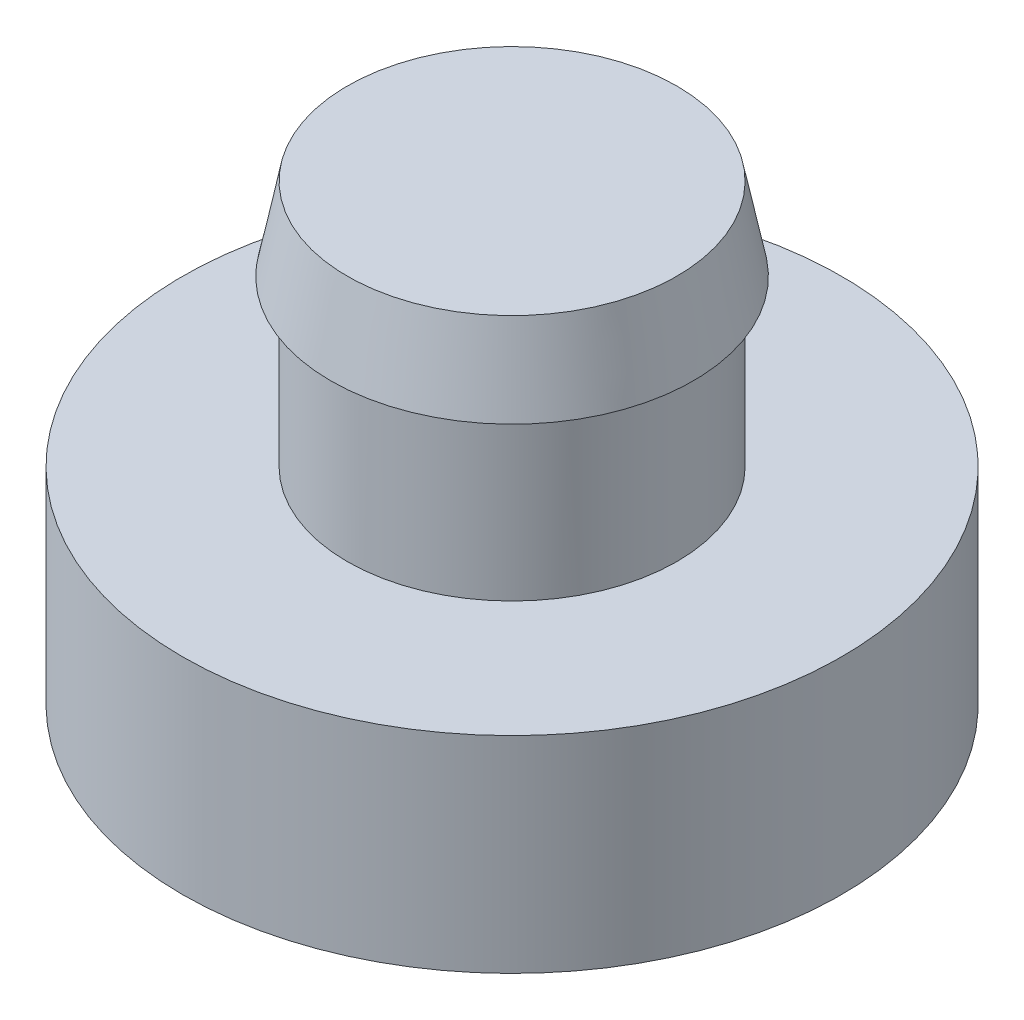
from build123d import *

# Parameters (mm, degrees)
SKETCH1_R           = 4
BOSS_EXTRUDE1_DEPTH = 2.5
SKETCH2_R           = 2
BOSS_EXTRUDE2_DEPTH = 3


with BuildPart() as part:
    # Sketch1 → Boss-Extrude1 (new body)
    with BuildSketch(Plane(origin=(0, 0, 0), x_dir=(1, 0, 0), z_dir=(0, 1, 0))):
        with Locations(Location((0, 0, 0), (0, 0, 270))):
            Circle(SKETCH1_R)
    extrude(amount=BOSS_EXTRUDE1_DEPTH)

    # Sketch2 → Boss-Extrude2 (add)
    with BuildSketch(Plane(origin=(0, 2.5, 0), x_dir=(1, 0, 0), z_dir=(0, 1, 0))):
        with Locations(Location((0, 0, 0), (0, 0, 270))):
            Circle(SKETCH2_R)
    extrude(amount=BOSS_EXTRUDE2_DEPTH)

    # Sketch3 → Revolve1 (revolve)
    with BuildSketch(Plane.XY, mode=Mode.PRIVATE) as revolve1_sk:
        Polygon((2, 5.5), (2, 4.5), (2.2, 4.5), align=None)
    revolve(revolve1_sk.sketch.rotate(Axis((0, 0, 0), (0, 1, 0)), 90), axis=Axis((0, 0, 0), (0, 1, 0)))


solid = part.part
